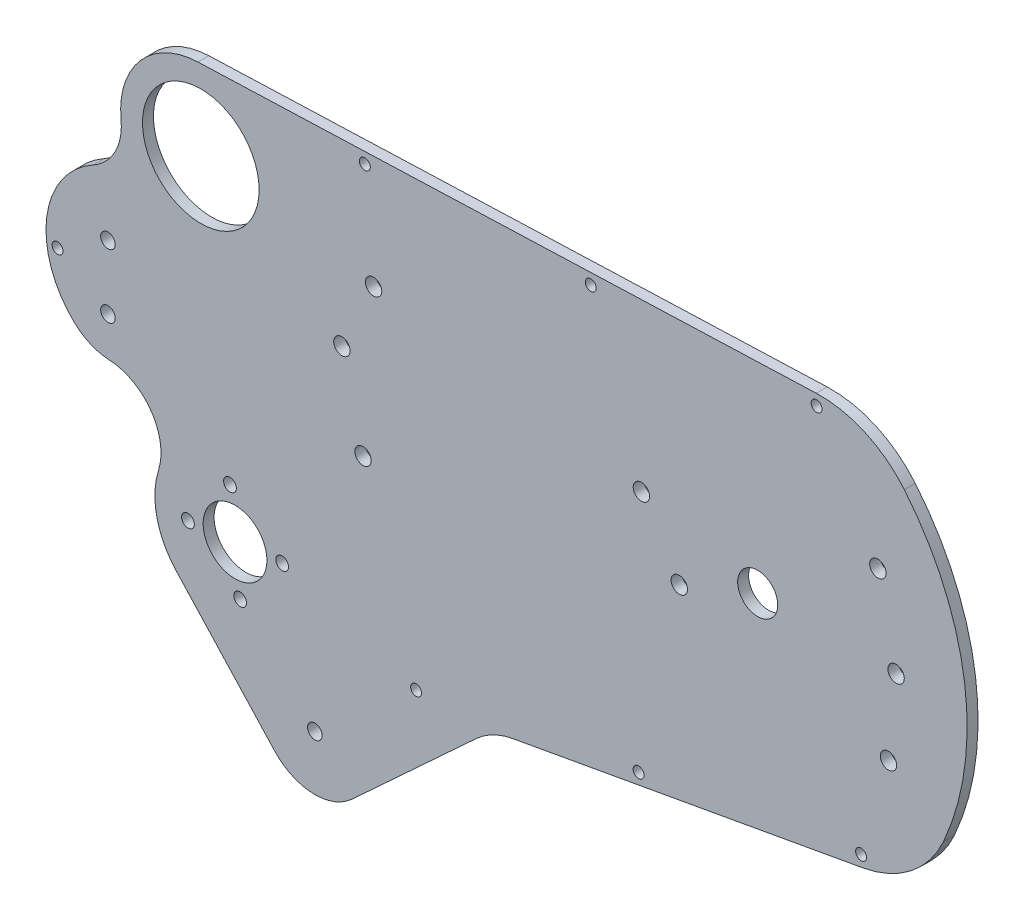
from build123d import *

# Parameters (mm, degrees)
SKETCH1_R           = 2
SKETCH1_R_2         = 2.25
SKETCH1_R_3         = 16
SKETCH1_R_4         = 5.5
SKETCH1_R_5         = 1.75
SKETCH1_R_6         = 8.75
BOSS_EXTRUDE1_DEPTH = 3
SKETCH2_R           = 1.5
CUT_EXTRUDE1_DEPTH  = 190.515777006


with BuildPart() as part:
    # Sketch1 → Boss-Extrude1 (new body)
    with BuildSketch(Plane.XY):
        with BuildLine():
            ThreePointArc((-137.970351553, -33.480224156), (-126.431132561, -39.888203569), (-124.422839539, -52.93360637))
            ThreePointArc((-124.422839539, -52.93360637), (-124.888175134, -64.31939994), (-119.594822483, -74.410646153))
            Line((-119.594822483, -74.410646153), (-92.540517723, -103.740413224))
            ThreePointArc((-92.540517723, -103.740413224), (-82.119700521, -108.557935129), (-71.344567605, -104.595807028))
            Line((-71.344567605, -104.595807028), (-37.221129556, -73.119733925))
            ThreePointArc((-37.221129556, -73.119733925), (-32.538343047, -69.892896145), (-27.140055215, -68.104192696))
            Line((-27.140055215, -68.104192696), (68.925058584, -50.795851294))
            ThreePointArc((68.925058584, -50.795851294), (82.107908339, -44.886103489), (91, -33.5))
            ThreePointArc((91, -33.5), (96.805715124, 7.17766304), (80.26119478, 44.789595257))
            ThreePointArc((80.26119478, 44.789595257), (69.434281248, 53.01522195), (56.08825014, 55.616461034))
            Line((56.08825014, 55.616461034), (-113.612396892, 49.485657177))
            ThreePointArc((-113.612396892, 49.485657177), (-129.404309407, 41.953313258), (-134.705774542, 25.279526249))
            ThreePointArc((-134.705774542, 25.279526249), (-136.343375771, 16.802270376), (-142.382746132, 10.632050724))
            ThreePointArc((-142.382746132, 10.632050724), (-155.099864059, -8.058287742), (-147.542861296, -29.364285714))
            ThreePointArc((-147.542861296, -29.364285714), (-143.125485566, -32.280163581), (-137.970351553, -33.480224156))
        make_face()
        with Locations((-81.514845762, -93.570135067)):
            Circle(SKETCH1_R, mode=Mode.SUBTRACT)
        with Locations((-138.3, -22.75)):
            Circle(SKETCH1_R, mode=Mode.SUBTRACT)
        with Locations((-138.3, -5.25)):
            Circle(SKETCH1_R, mode=Mode.SUBTRACT)
        with Locations((-68.3, -21.5)):
            Circle(SKETCH1_R_2, mode=Mode.SUBTRACT)
        with Locations((-74.1, 1.7)):
            Circle(SKETCH1_R_2, mode=Mode.SUBTRACT)
        with Locations((-112.818118288, 27.5)):
            Circle(SKETCH1_R_3, mode=Mode.SUBTRACT)
        with Locations((-65.4, 20.2)):
            Circle(SKETCH1_R_2, mode=Mode.SUBTRACT)
        with Locations((18.5, -8.7)):
            Circle(SKETCH1_R_2, mode=Mode.SUBTRACT)
        with Locations((8.1, 8.2)):
            Circle(SKETCH1_R_2, mode=Mode.SUBTRACT)
        with Locations((75.9, -21.8)):
            Circle(SKETCH1_R_2, mode=Mode.SUBTRACT)
        with Locations((40.017782272, 0)):
            Circle(SKETCH1_R_4, mode=Mode.SUBTRACT)
        with Locations((78, -0.1)):
            Circle(SKETCH1_R_2, mode=Mode.SUBTRACT)
        with Locations((73, 22.4)):
            Circle(SKETCH1_R_2, mode=Mode.SUBTRACT)
        with Locations((-90.498978695, -58.098516388)):
            Circle(SKETCH1_R_5, mode=Mode.SUBTRACT)
        with Locations((-102.02811514, -72.419096433)):
            Circle(SKETCH1_R_5, mode=Mode.SUBTRACT)
        with Locations((-116.348695186, -60.889959988)):
            Circle(SKETCH1_R_5, mode=Mode.SUBTRACT)
        with Locations((-103.42383694, -59.494238188)):
            Circle(SKETCH1_R_6, mode=Mode.SUBTRACT)
        with Locations((-104.819558741, -46.569379943)):
            Circle(SKETCH1_R_5, mode=Mode.SUBTRACT)
    extrude(amount=BOSS_EXTRUDE1_DEPTH)

    # Sketch2 → Cut-Extrude1 (cut, through all)
    with BuildSketch(Plane.XY.offset(3)):
        with Locations((56.196560986, 52.618416878)):
            Circle(SKETCH2_R)
        with Locations((-5.803439014, 50.378532436)):
            Circle(SKETCH2_R)
        with Locations((-67.803439014, 48.138647993)):
            Circle(SKETCH2_R)
        with Locations((68.393104802, -47.843390427)):
            Circle(SKETCH2_R)
        with Locations((7.335774003, -58.84427394)):
            Circle(SKETCH2_R)
        with Locations((-152.133709173, -14)):
            Circle(SKETCH2_R)
        with Locations((-53.721556796, -69.845157453)):
            Circle(SKETCH2_R)
    extrude(amount=-CUT_EXTRUDE1_DEPTH, mode=Mode.SUBTRACT)


solid = part.part
